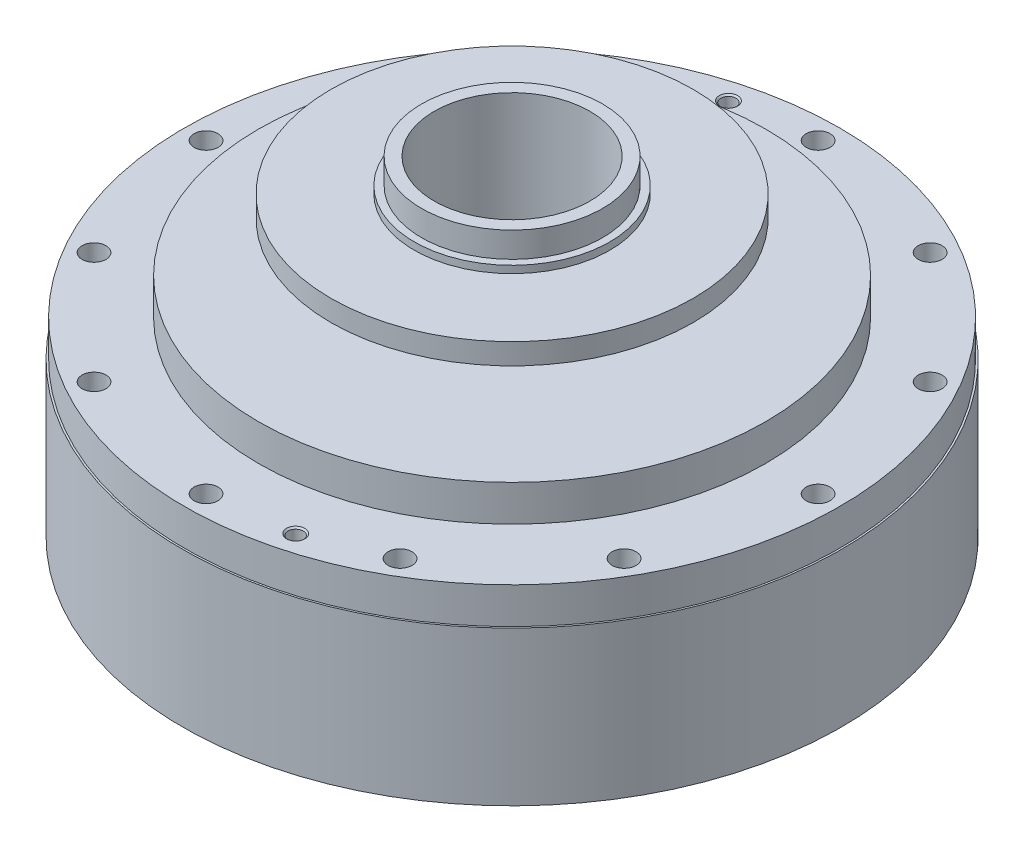
from build123d import *

# Parameters (mm, degrees)
SKETCH3_R                       = 3.3
CUT_EXTRUDE2_DEPTH              = 158.616623489
M8_TAPPED_HOLE1_D               = 6.8
M8_TAPPED_HOLE1_DEPTH           = 23.75
M8_TAPPED_HOLE1_CSINK_D         = 8.05
M8_TAPPED_HOLE1_CSINK_ANGLE     = 90
M8_TAPPED_HOLE1_TIP             = 2.042926105
M5X0_8_TAPPED_HOLE2_D           = 4.2
M5X0_8_TAPPED_HOLE2_CSINK_D     = 5.05
M5X0_8_TAPPED_HOLE2_CSINK_ANGLE = 90
M4_TAPPED_HOLE1_D               = 3.3
M4_TAPPED_HOLE1_DEPTH           = 20.1
M4_TAPPED_HOLE1_CSINK_D         = 4.05
M4_TAPPED_HOLE1_CSINK_ANGLE     = 90
M4_TAPPED_HOLE1_TIP             = 0.991420021


with BuildPart() as part:
    # Sketch1 → Revolve1 (revolve)
    with BuildSketch(Plane(origin=(0, 0, 0), x_dir=(0, 0, -1), z_dir=(1, 0, 0)), mode=Mode.PRIVATE) as revolve1_sk:
        Polygon((-33, 0), (-70, 0), (-70, 5), (-91, 5), (-91, 47.5), (-90.5, 47.5), (-90.5, 57.5), (-70, 57.5), (-70, 67.5), (-29.6, 67.5), (-29.6, 81.2), (-50, 81.2), (-50, 87), (-27, 87), (-27, 89), (-25, 89), (-25, 96), (-21.5, 96), (-21.5, 30), (-23.5, 30), (-23.5, 9.2), (-33, 9.2), align=None)
    revolve(revolve1_sk.sketch.rotate(Axis((0, -94.12, 0), (0, 1, 0)), 180), axis=Axis((0, -94.12, 0), (0, 1, 0)))

    # Sketch3 → Cut-Extrude2 (cut, through all)
    with BuildSketch(Plane.XZ.offset(-5)):
        with Locations(Location((-84.5, 0, 0), (0, 0, 270))):
            Circle(SKETCH3_R)
        with Locations(Location((-73.17914662, 42.25, 0), (0, 0, 270))):
            Circle(SKETCH3_R)
        with Locations(Location((-42.25, 73.17914662, 0), (0, 0, 270))):
            Circle(SKETCH3_R)
        with Locations(Location((0, 84.5, 0), (0, 0, 270))):
            Circle(SKETCH3_R)
        with Locations(Location((42.25, 73.17914662, 0), (0, 0, 270))):
            Circle(SKETCH3_R)
        with Locations(Location((73.17914662, 42.25, 0), (0, 0, 270))):
            Circle(SKETCH3_R)
        with Locations(Location((84.5, 0, 0), (0, 0, 270))):
            Circle(SKETCH3_R)
        with Locations(Location((73.17914662, -42.25, 0), (0, 0, 270))):
            Circle(SKETCH3_R)
        with Locations(Location((42.25, -73.17914662, 0), (0, 0, 270))):
            Circle(SKETCH3_R)
        with Locations(Location((0, -84.5, 0), (0, 0, 270))):
            Circle(SKETCH3_R)
        with Locations(Location((-42.25, -73.17914662, 0), (0, 0, 270))):
            Circle(SKETCH3_R)
        with Locations(Location((-73.17914662, -42.25, 0), (0, 0, 270))):
            Circle(SKETCH3_R)
    extrude(amount=-CUT_EXTRUDE2_DEPTH, mode=Mode.SUBTRACT)

    # M8 Tapped Hole1
    with Locations(Plane(origin=(0, 0, 0), x_dir=(-1, 0, 0), z_dir=(0, -1, 0))):
        with Locations((15.011504616, 56.023697925), (-29, 50.229473419), (-56.023697925, 15.011504616), (-50.229473419, -29), (-15.011504616, -56.023697925), (29, -50.229473419), (56.023697925, -15.011504616), (50.229473419, 29)):
            CounterSinkHole(M8_TAPPED_HOLE1_D / 2, M8_TAPPED_HOLE1_CSINK_D / 2, depth=M8_TAPPED_HOLE1_DEPTH, counter_sink_angle=M8_TAPPED_HOLE1_CSINK_ANGLE)
            with Locations((0, 0, -(M8_TAPPED_HOLE1_DEPTH + M8_TAPPED_HOLE1_TIP / 2))):  # 118° drill point
                Cone(0, M8_TAPPED_HOLE1_D / 2, M8_TAPPED_HOLE1_TIP, mode=Mode.SUBTRACT)

    # M5x0.8 Tapped Hole2 (through all)
    with Locations(Plane(origin=(0, 57.5, 0), x_dir=(1, 0, 0), z_dir=(0, 1, 0))):
        with Locations((-21.870209311, 81.620732321), (21.870209311, -81.620732321)):
            CounterSinkHole(M5X0_8_TAPPED_HOLE2_D / 2, M5X0_8_TAPPED_HOLE2_CSINK_D / 2, counter_sink_angle=M5X0_8_TAPPED_HOLE2_CSINK_ANGLE)

    # M4 Tapped Hole1
    with Locations(Plane(origin=(-19.798989873, 9.2, 19.798989873), x_dir=(0, 0, -1), z_dir=(0, -1, 0))):
        with Locations((0, 0), (0, 39.597979746), (39.597979746, 39.597979746), (39.597979746, 0)):
            CounterSinkHole(M4_TAPPED_HOLE1_D / 2, M4_TAPPED_HOLE1_CSINK_D / 2, depth=M4_TAPPED_HOLE1_DEPTH, counter_sink_angle=M4_TAPPED_HOLE1_CSINK_ANGLE)
            with Locations((0, 0, -(M4_TAPPED_HOLE1_DEPTH + M4_TAPPED_HOLE1_TIP / 2))):  # 118° drill point
                Cone(0, M4_TAPPED_HOLE1_D / 2, M4_TAPPED_HOLE1_TIP, mode=Mode.SUBTRACT)


solid = part.part
